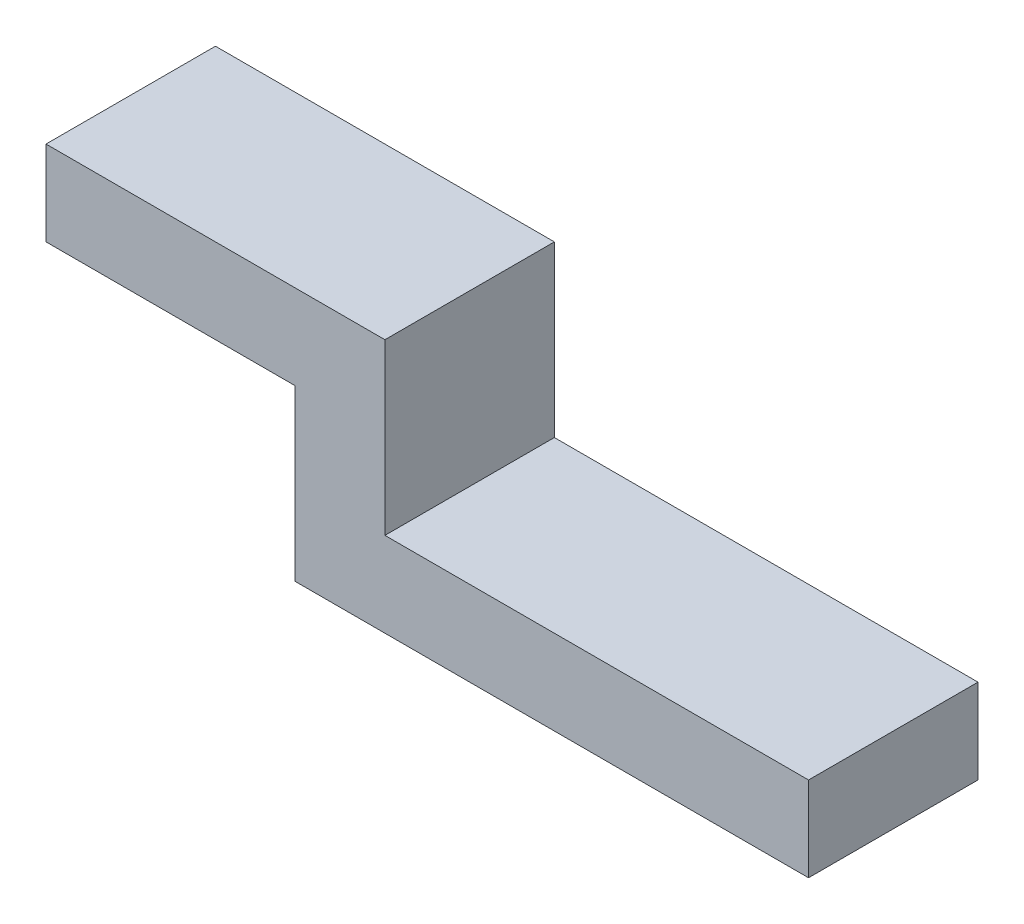
from build123d import *

# Parameters (mm, degrees)
BOSS_EXTRUDE8_DEPTH = 2.54


with BuildPart() as part:
    # Sketch1 → Boss-Extrude8 (new body)
    with BuildSketch(Plane.XY):
        Polygon((0, 19.559297466), (7.694424421, 19.559297466), (7.694424421, 20.829297466), (1.344424421, 20.829297466), (1.344424421, 23.369297466), (-3.735575579, 23.369297466), (-3.735575579, 22.099297466), (0, 22.099297466), align=None)
    extrude(amount=BOSS_EXTRUDE8_DEPTH)


solid = part.part
